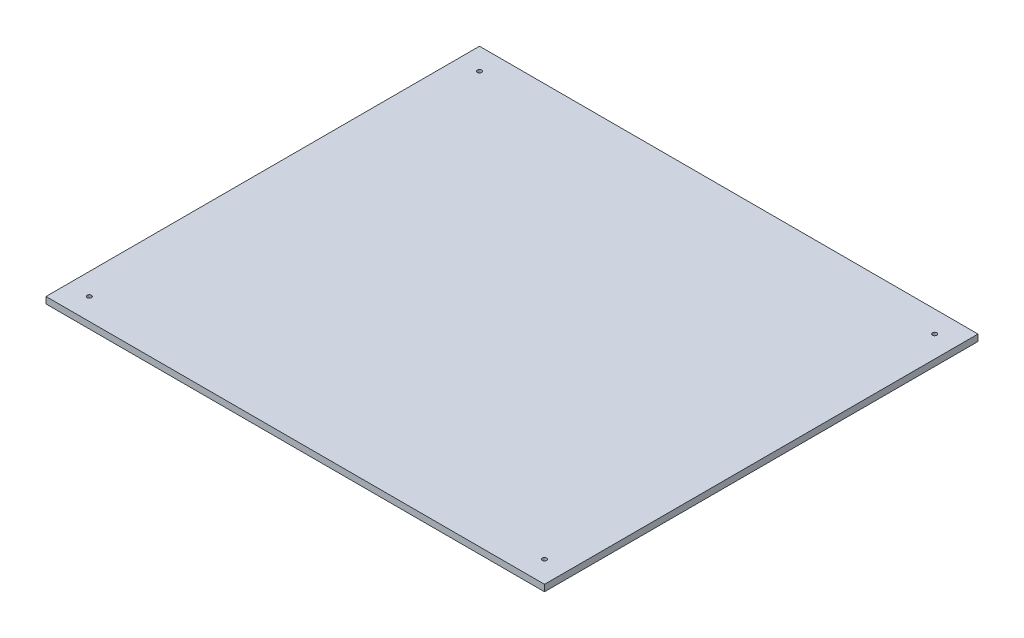
from build123d import *

# Parameters (mm, degrees)
SKETCH1_W           = 230
SKETCH1_H           = 200
SKETCH1_R           = 1
BOSS_EXTRUDE1_DEPTH = 3


with BuildPart() as part:
    # Sketch1 → Boss-Extrude1 (new body)
    with BuildSketch(Plane(origin=(0, 0, 0), x_dir=(1, 0, 0), z_dir=(0, 1, 0))):
        Rectangle(SKETCH1_W, SKETCH1_H)
        with Locations(Location((-105, 90, 0), (0, 0, 270))):
            Circle(SKETCH1_R, mode=Mode.SUBTRACT)
        with Locations(Location((105, 90, 0), (0, 0, 90))):
            Circle(SKETCH1_R, mode=Mode.SUBTRACT)
        with Locations(Location((105, -90, 0), (0, 0, 270))):
            Circle(SKETCH1_R, mode=Mode.SUBTRACT)
        with Locations(Location((-105, -90, 0), (0, 0, 90))):
            Circle(SKETCH1_R, mode=Mode.SUBTRACT)
    extrude(amount=BOSS_EXTRUDE1_DEPTH)


solid = part.part
